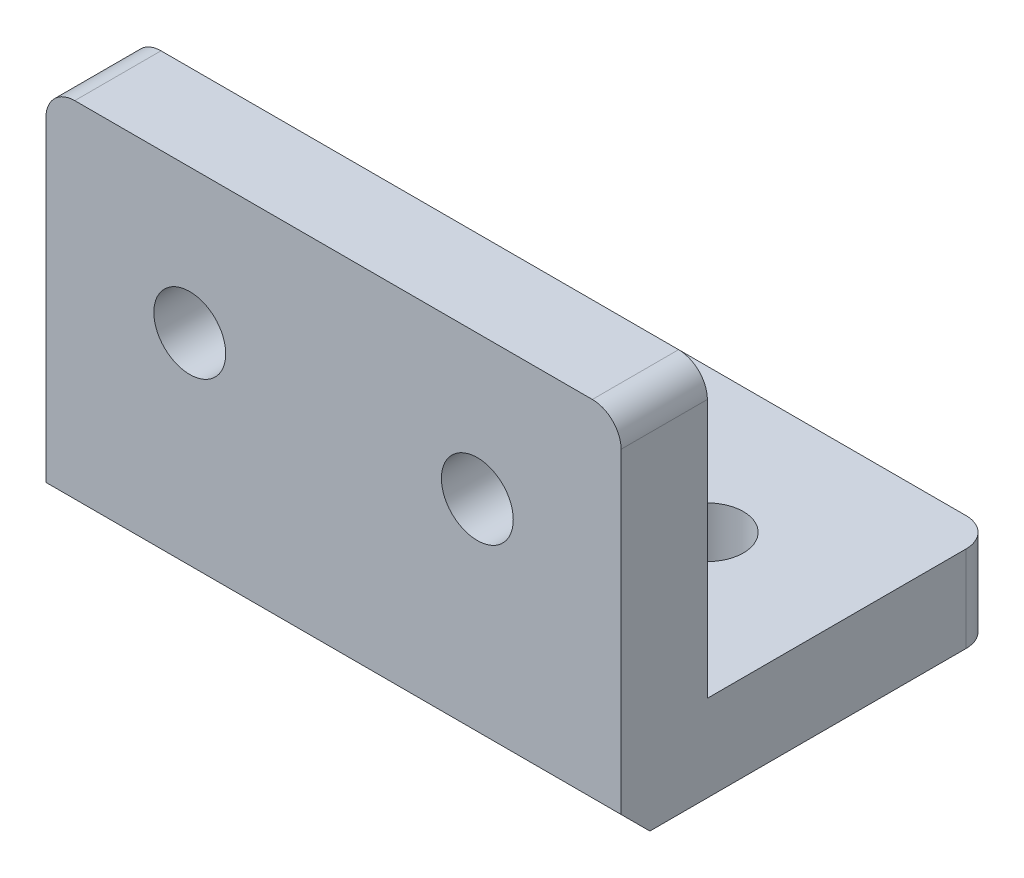
from build123d import *

# Parameters (mm, degrees)
SKETCH1_R           = 2.5
BOSS_EXTRUDE2_DEPTH = 6
SKETCH3_W           = 40
SKETCH3_H           = 6
BOSS_EXTRUDE3_DEPTH = 26
SKETCH4_R           = 2.5
CUT_EXTRUDE2_DEPTH  = 26
CHAMFER1_SIZE       = 2


with BuildPart() as part:
    # Sketch1 → Boss-Extrude2 (new body)
    with BuildSketch(Plane.XY):
        with BuildLine():
            Line((-20, -9.25), (20, -9.25))
            Line((20, -9.25), (20, 8.75))
            ThreePointArc((20, 8.75), (19.414213562, 10.164213562), (18, 10.75))
            Line((18, 10.75), (-18, 10.75))
            ThreePointArc((-18, 10.75), (-19.414213562, 10.164213562), (-20, 8.75))
            Line((-20, 8.75), (-20, -9.25))
        make_face()
        with Locations((-10, 0.75)):
            Circle(SKETCH1_R, mode=Mode.SUBTRACT)
        with Locations((10, 0.75)):
            Circle(SKETCH1_R, mode=Mode.SUBTRACT)
    extrude(amount=BOSS_EXTRUDE2_DEPTH)

    # Sketch3 → Boss-Extrude3 (add)
    with BuildSketch(Plane.XY.offset(6)):
        with Locations((0, -12.25)):
            Rectangle(SKETCH3_W, SKETCH3_H)
    extrude(amount=-BOSS_EXTRUDE3_DEPTH)

    # Sketch4 → Cut-Extrude2 (cut)
    with BuildSketch(Plane.XZ.offset(15.25)):
        with Locations((-10, -10)):
            Circle(SKETCH4_R)
        with Locations((10, -10)):
            Circle(SKETCH4_R)
        with BuildLine():
            Line((-20, -20), (-18, -20))
            ThreePointArc((-18, -20), (-19.414213562, -19.414213562), (-20, -18))
            Line((-20, -18), (-20, -20))
        make_face()
        with BuildLine():
            ThreePointArc((20, -18), (19.414213562, -19.414213562), (18, -20))
            Line((18, -20), (20, -20))
            Line((20, -20), (20, -18))
        make_face()
    extrude(amount=-CUT_EXTRUDE2_DEPTH, mode=Mode.SUBTRACT)

    # Chamfer1
    chamfer1_edges = [part.edges().sort_by_distance(p)[0] for p in [
        (0, -15.25, 6),
    ]]
    chamfer(chamfer1_edges, length=CHAMFER1_SIZE)


solid = part.part
